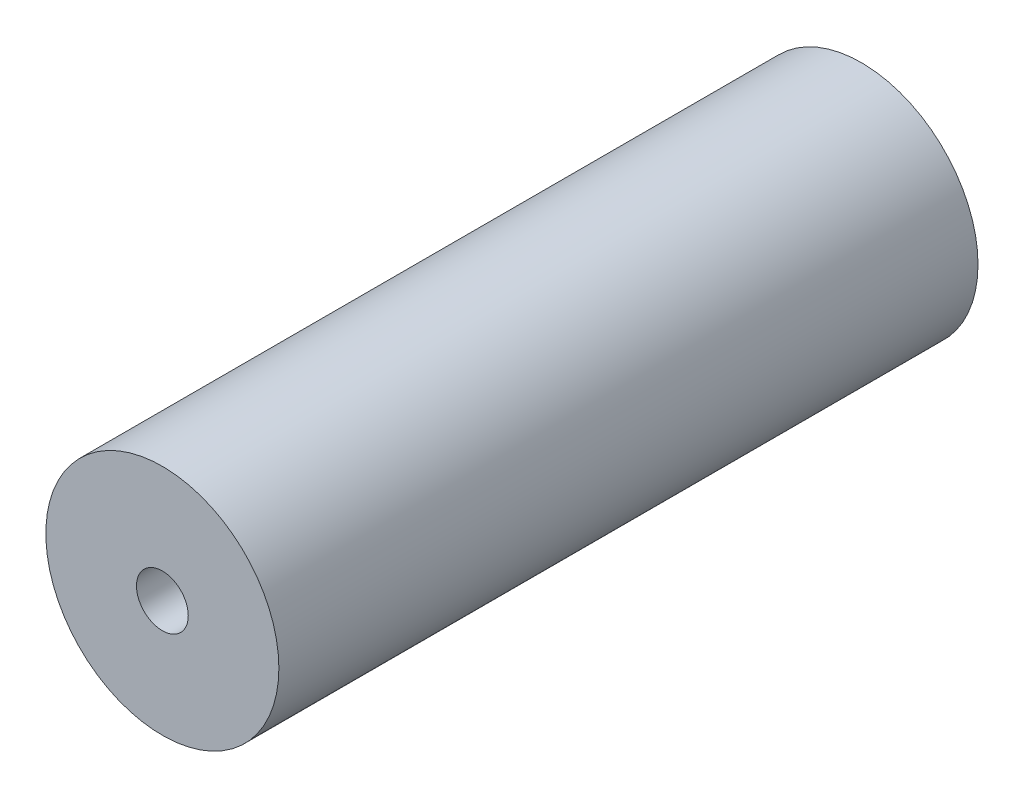
from build123d import *

# Parameters (mm, degrees)
BOSS_EXTRUDE1_DEPTH      = 54
BOSS_EXTRUDE1_DEPTH_BACK = 54
SKETCH2_R                = 18
SKETCH3_R                = 4
CUT_EXTRUDE1_DEPTH       = 122
SKETCH4_R                = 1.5
CUT_EXTRUDE2_DEPTH       = 5


with BuildPart() as part:
    # Sketch2 → Boss-Extrude1 (new, two sides: drawn at the far end of the back side and taken through both)
    with BuildSketch(Plane.XY.offset(-BOSS_EXTRUDE1_DEPTH_BACK)):
        Circle(SKETCH2_R)
    extrude(amount=BOSS_EXTRUDE1_DEPTH + BOSS_EXTRUDE1_DEPTH_BACK)

    # Sketch3 → Cut-Extrude1 (cut)
    with BuildSketch(Plane.XY.offset(54)):
        Circle(SKETCH3_R)
    extrude(amount=-CUT_EXTRUDE1_DEPTH, mode=Mode.SUBTRACT)

    # Sketch4 → Cut-Extrude2 (cut)
    with BuildSketch(Plane(origin=(0, 0, -54), x_dir=(-1, 0, 0), z_dir=(0, 0, -1))):
        with Locations((0, 14)):
            Circle(SKETCH4_R)
        with Locations((14, 0)):
            Circle(SKETCH4_R)
        with Locations((0, -14)):
            Circle(SKETCH4_R)
        with Locations((-14, 0)):
            Circle(SKETCH4_R)
    extrude(amount=-CUT_EXTRUDE2_DEPTH, mode=Mode.SUBTRACT)


solid = part.part
